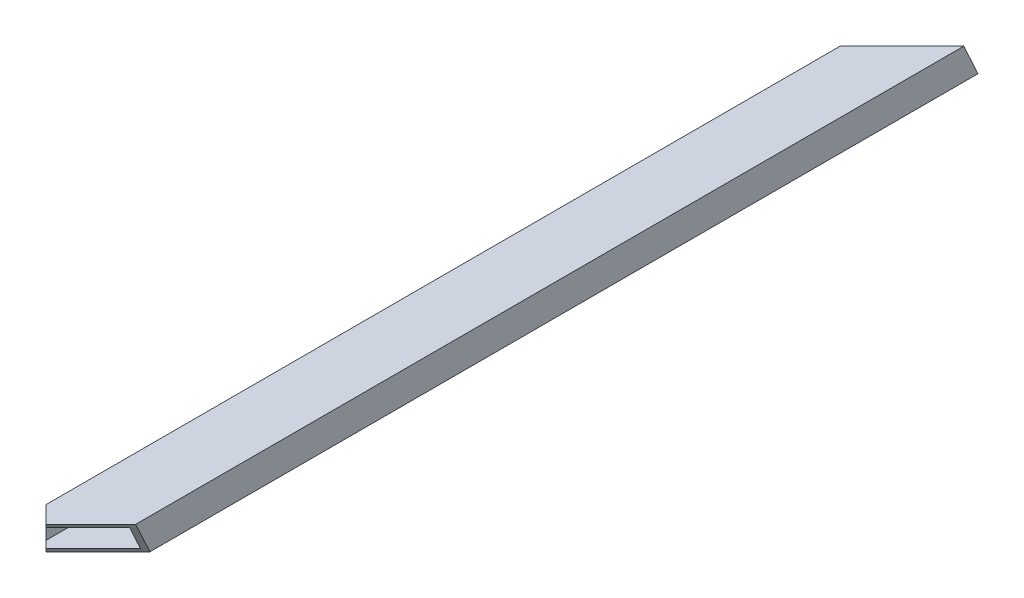
from build123d import *

# Parameters (mm, degrees)
SKETCH1_W                = 50.8
SKETCH1_H                = 25.4
SKETCH1_W_2              = 44.45
SKETCH1_H_2              = 19.05
BOSS_EXTRUDE1_DEPTH      = 771.9314
CUT_EXTRUDE1_DEPTH       = 773.76672179
SKETCH10_W               = 90.356784756
SKETCH10_H               = 129.906903396
CUT_EXTRUDE8_DEPTH       = 40.64
CUT_EXTRUDE9_DEPTH       = 1230.239509376
CUT_EXTRUDE10_DEPTH      = 567.92953801
CUT_EXTRUDE10_DEPTH_BACK = 567.92953801


with BuildPart() as part:
    # Sketch1 → Boss-Extrude1 (new body)
    with BuildSketch(Plane.XY):
        Rectangle(SKETCH1_W, SKETCH1_H)
        Rectangle(SKETCH1_W_2, SKETCH1_H_2, mode=Mode.SUBTRACT)
    extrude(amount=BOSS_EXTRUDE1_DEPTH)

    # Sketch2 → Cut-Extrude1 (cut, through all)
    with BuildSketch(Plane(origin=(0, 12.7, 0), x_dir=(1, 0, 0), z_dir=(0, 1, 0))):
        Polygon((25.4, 0), (-25.4, -50.8), (-25.4, 0), align=None)
        Polygon((-25.4, -771.9314), (25.4, -721.1314), (25.4, -771.9314), align=None)
    extrude(amount=-CUT_EXTRUDE1_DEPTH, mode=Mode.SUBTRACT)

    # Sketch10 → Cut-Extrude8 (cut)
    with BuildSketch(Plane(origin=(-369.87845504, 0, 369.87845504), x_dir=(-0.7071067811865528, 0, -0.7071067811865422), z_dir=(0.7071067811865422, 0, -0.7071067811865528))):
        with Locations((-494.442187508, 23.675993241)):
            Rectangle(SKETCH10_W, SKETCH10_H)
    extrude(amount=-CUT_EXTRUDE8_DEPTH, mode=Mode.SUBTRACT)


with BuildPart() as cut_extrude8_piece_1:
    # of the separate pieces the step leaves, piece 1, a body of its own (cut_extrude8_pieces)
    add(part.part.solids().sort_by_distance((25.4, -12.7, 0))[0])

    # Sketch11 → Cut-Extrude9 (cut, through all)
    with BuildSketch(Plane(origin=(386.259110354, 0, -386.259110354), x_dir=(-0.7071067811865541, -3.472433466129024e-15, -0.7071067811865409), z_dir=(0.7071067811865409, -3.4724334661290888e-15, -0.7071067811865541))):
        Polygon((-17.960512242, -12.7), (-26.213472526, 12.7), (-17.960512242, 12.7), align=None)
    extrude(amount=-CUT_EXTRUDE9_DEPTH, mode=Mode.SUBTRACT)


with BuildPart() as cut_extrude8_piece_2:
    # of the separate pieces the step leaves, piece 2, a body of its own (cut_extrude8_pieces)
    add(part.part.solids().sort_by_distance((-25.349574627, -12.7, 771.880974627))[0])


with BuildPart() as cut_extrude10_tool:
    # Sketch12 → Cut-Extrude10 (new, two sides: drawn at the far end of the back side and taken through both)
    with BuildSketch(Plane(origin=(-332.161379331, 0, 332.161379331), x_dir=(-0.7071067811865526, 0, -0.7071067811865425), z_dir=(0.7071067811865425, 0, -0.7071067811865526)).offset(-CUT_EXTRUDE10_DEPTH_BACK)):
        Polygon((-498.689041164, -12.7), (-506.942001448, 12.7), (-527.877415309, 12.7), (-527.877415309, -12.7), align=None)
    extrude(amount=CUT_EXTRUDE10_DEPTH + CUT_EXTRUDE10_DEPTH_BACK)


with BuildPart() as cut_extrude8_piece_1_1:
    add(cut_extrude8_piece_1.part)

    # Cut-Extrude10: cut by cut_extrude10_tool
    add(cut_extrude10_tool.part, mode=Mode.SUBTRACT)


with BuildPart() as cut_extrude8_piece_2_1:
    add(cut_extrude8_piece_2.part)

    # Cut-Extrude10: cut by cut_extrude10_tool
    add(cut_extrude10_tool.part, mode=Mode.SUBTRACT)


solid = cut_extrude8_piece_1_1.part
